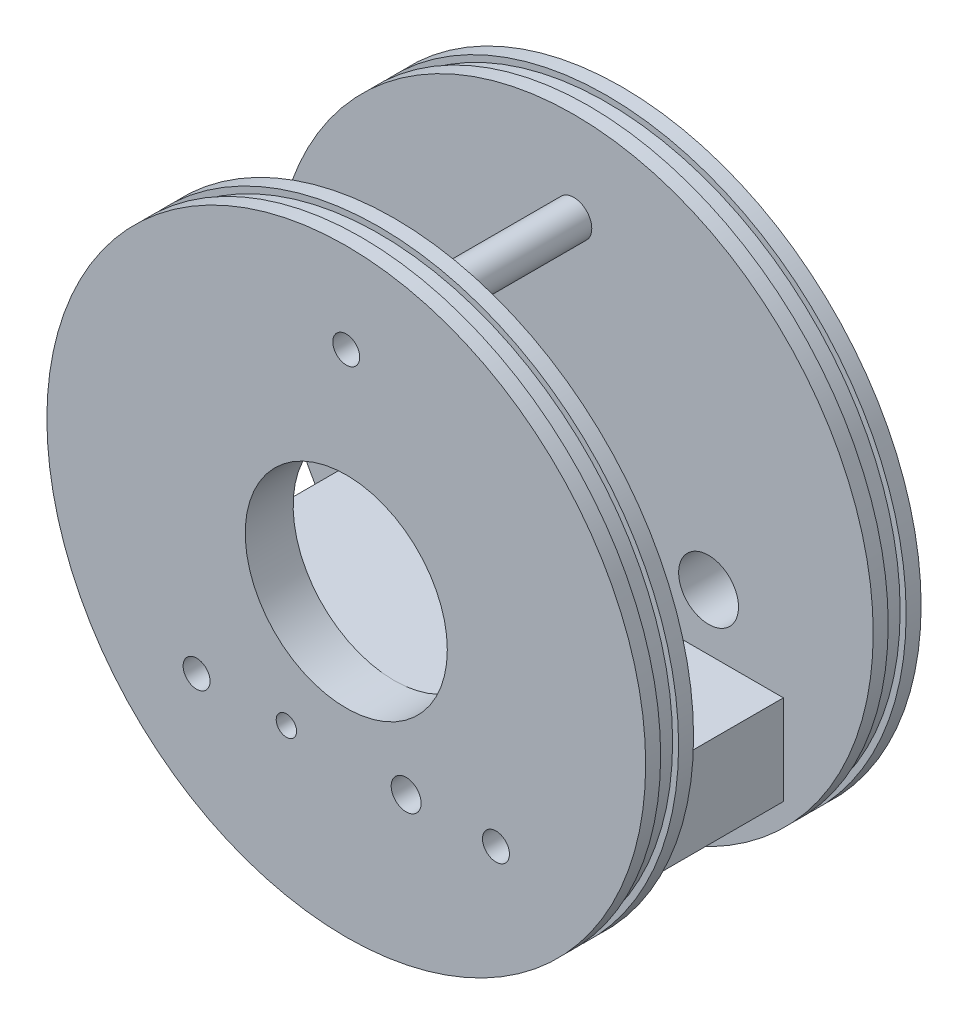
from build123d import *

# Parameters (mm, degrees)
BOSS_EXTRUDE1_DEPTH      = 8
BOSS_EXTRUDE1_DEPTH_BACK = 8
SKETCH2_R                = 100
CUT_EXTRUDE1_DEPTH       = 3
CUT_EXTRUDE1_DEPTH_BACK  = 3
SKETCH2_5_R              = 100
SKETCH2_5_R_2            = 98
LPATTERN1_COUNT          = 2
LPATTERN1_PITCH          = 76
SKETCH5_W                = 140
SKETCH5_H                = 60
SKETCH5_R                = 3.2
BOSS_EXTRUDE2_DEPTH      = 30
SKETCH7_R                = 4.5
SKETCH7_R_2              = 3.4
SKETCH7_R_3              = 5
CUT_EXTRUDE2_DEPTH       = 167
SKETCH3_R                = 33.75
CUT_EXTRUDE3_DEPTH       = 43
SKETCH10_R               = 6
BOSS_EXTRUDE3_DEPTH      = 60
CUT_EXTRUDE4_DEPTH       = 112
CUT_EXTRUDE4_DEPTH_BACK  = 60
SKETCH10_4_R             = 4.5
SKETCH11_R               = 10
CUT_EXTRUDE5_DEPTH       = 60


with BuildPart() as part:
    # Sketch2 → Boss-Extrude1 (new, two sides: drawn at the far end of the back side and taken through both)
    with BuildSketch(Plane.XY.offset(-BOSS_EXTRUDE1_DEPTH_BACK)):
        Circle(SKETCH2_R)
    extrude(amount=BOSS_EXTRUDE1_DEPTH + BOSS_EXTRUDE1_DEPTH_BACK)

    # Sketch2<5> → Cut-Extrude1 (cut, two sides: drawn at the far end of the back side and taken through both)
    with BuildSketch(Plane.XY.offset(-CUT_EXTRUDE1_DEPTH_BACK)):
        Circle(SKETCH2_5_R)
        Circle(SKETCH2_5_R_2, mode=Mode.SUBTRACT)
    extrude(amount=CUT_EXTRUDE1_DEPTH + CUT_EXTRUDE1_DEPTH_BACK, mode=Mode.SUBTRACT)


with BuildPart() as lpattern1_1:
    # LPattern1: pattern copy
    add(part.part.moved(Location(Vector(0, 0, -1) * (1 * LPATTERN1_PITCH))))


with BuildPart() as part_1:
    add(part.part)

    # Sketch5 → Boss-Extrude2 (add)
    with BuildSketch(Plane(origin=(0, -33.75, 0), x_dir=(1, 0, 0), z_dir=(0, 1, 0))):
        with Locations((0, 38)):
            Rectangle(SKETCH5_W, SKETCH5_H)
        with Locations((0, 43)):
            Circle(SKETCH5_R, mode=Mode.SUBTRACT)
    extrude(amount=-BOSS_EXTRUDE2_DEPTH)


with BuildPart() as cut_extrude2_tool:
    # Sketch7 → Cut-Extrude2 (new body)
    with BuildSketch(Plane.XY.offset(8)):
        with Locations((-50, -48.75)):
            Circle(SKETCH7_R)
        with Locations((50, -48.75)):
            Circle(SKETCH7_R)
        with Locations((-20, -48.75)):
            Circle(SKETCH7_R_2)
        with Locations((20, -48.75)):
            Circle(SKETCH7_R_3)
    extrude(amount=-CUT_EXTRUDE2_DEPTH)


with BuildPart() as part_2:
    add(part_1.part)

    # Cut-Extrude2: cut by cut_extrude2_tool
    add(cut_extrude2_tool.part, mode=Mode.SUBTRACT)

    # Sketch3 → Cut-Extrude3 (cut)
    with BuildSketch(Plane.XY.offset(8)):
        Circle(SKETCH3_R)
    extrude(amount=-CUT_EXTRUDE3_DEPTH, mode=Mode.SUBTRACT)



with BuildPart() as lpattern1_1_1:
    add(lpattern1_1.part)

    # Cut-Extrude2: cut by cut_extrude2_tool
    add(cut_extrude2_tool.part, mode=Mode.SUBTRACT)


with BuildPart() as part_3:
    add(part_2.part)

    add(lpattern1_1_1.part)  # Boss-Extrude3 merges LPattern1_1
    # Sketch10 → Boss-Extrude3 (add)
    with BuildSketch(Plane(origin=(0, 0, -8), x_dir=(-1, 0, 0), z_dir=(0, 0, -1))):
        with Locations((0, 70)):
            Circle(SKETCH10_R)
    extrude(amount=BOSS_EXTRUDE3_DEPTH)

    # Sketch10<4> → Cut-Extrude4 (cut, two sides: drawn at the far end of the back side and taken through both)
    with BuildSketch(Plane(origin=(0, 0, -8), x_dir=(-1, 0, 0), z_dir=(0, 0, -1)).offset(-CUT_EXTRUDE4_DEPTH_BACK)):
        with Locations((0, 70)):
            Circle(SKETCH10_4_R)
    extrude(amount=CUT_EXTRUDE4_DEPTH + CUT_EXTRUDE4_DEPTH_BACK, mode=Mode.SUBTRACT)

    # Sketch11 → Cut-Extrude5 (cut)
    with BuildSketch(Plane(origin=(0, 0, -84), x_dir=(-1, 0, 0), z_dir=(0, 0, -1))):
        with Locations((-45, -15)):
            Circle(SKETCH11_R)
    extrude(amount=-CUT_EXTRUDE5_DEPTH, mode=Mode.SUBTRACT)


solid = part_3.part
